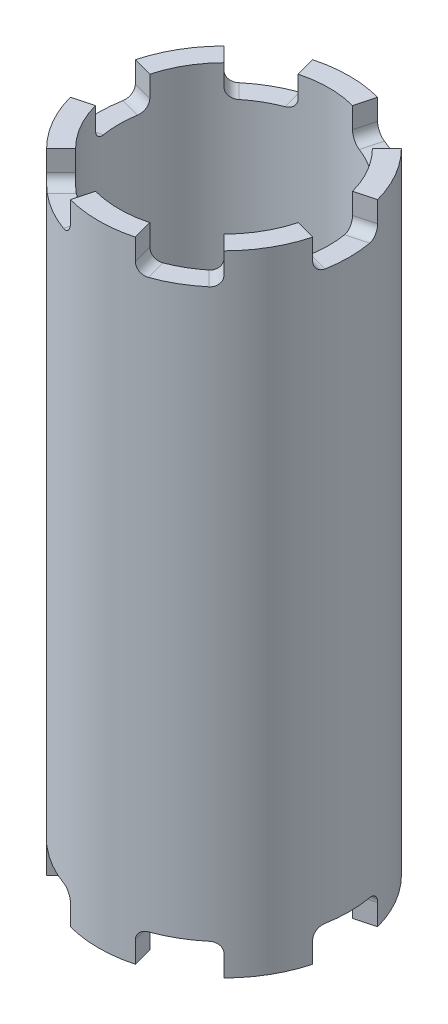
from build123d import *

# Parameters (mm, degrees)
SKETCH1_R            = 30.353
SKETCH1_R_2          = 25.4
BOSS_EXTRUDE1_DEPTH  = 152.4
CUT_EXTRUDE2_START   = -7.62
CUT_EXTRUDE2_DEPTH   = 7.62
FILLET1_R            = 2.54
FILLET1_OF_MIRROR1_R = 2.54


with BuildPart() as part:
    # Sketch1 → Boss-Extrude1 (new body)
    with BuildSketch(Plane(origin=(0, 0, 0), x_dir=(1, 0, 0), z_dir=(0, 1, 0))):
        with Locations(Location((0, 0, 0), (0, 0, 90))):
            Circle(SKETCH1_R)
        with Locations(Location((0, 0, 0), (0, 0, 90))):
            Circle(SKETCH1_R_2, mode=Mode.SUBTRACT)
    extrude(amount=BOSS_EXTRUDE1_DEPTH)

    # Sketch2 → Cut-Extrude2 (cut)
    with BuildSketch(Plane(origin=(0, 152.4, 0), x_dir=(1, 0, 0), z_dir=(0, 1, 0)).offset(CUT_EXTRUDE2_START)):
        with BuildLine():
            Line((24.534515988, 6.574003746), (29.318746605, 7.855934476))
            ThreePointArc((29.318746605, 7.855934476), (30.353, 0), (29.318746605, -7.855934476))
            Line((29.318746605, -7.855934476), (24.534515988, -6.574003746))
            ThreePointArc((24.534515988, -6.574003746), (25.4, 0), (24.534515988, 6.574003746))
        make_face()
        with BuildLine():
            Line((6.574003746, -24.534515988), (7.855934476, -29.318746605))
            ThreePointArc((7.855934476, -29.318746605), (15.1765, -26.286469081), (21.462812129, -21.462812129))
            Line((21.462812129, -21.462812129), (17.960512242, -17.960512242))
            ThreePointArc((17.960512242, -17.960512242), (12.7, -21.997045256), (6.574003746, -24.534515988))
        make_face()
        with BuildLine():
            Line((-17.960512242, -17.960512242), (-21.462812129, -21.462812129))
            ThreePointArc((-21.462812129, -21.462812129), (-15.1765, -26.286469081), (-7.855934476, -29.318746605))
            Line((-7.855934476, -29.318746605), (-6.574003746, -24.534515988))
            ThreePointArc((-6.574003746, -24.534515988), (-12.7, -21.997045256), (-17.960512242, -17.960512242))
        make_face()
        with BuildLine():
            Line((-24.534515988, 6.574003746), (-29.318746605, 7.855934476))
            ThreePointArc((-29.318746605, 7.855934476), (-30.353, 0), (-29.318746605, -7.855934476))
            Line((-29.318746605, -7.855934476), (-24.534515988, -6.574003746))
            ThreePointArc((-24.534515988, -6.574003746), (-25.4, 0), (-24.534515988, 6.574003746))
        make_face()
        with BuildLine():
            Line((-6.574003746, 24.534515988), (-7.855934476, 29.318746605))
            ThreePointArc((-7.855934476, 29.318746605), (-15.1765, 26.286469081), (-21.462812129, 21.462812129))
            Line((-21.462812129, 21.462812129), (-17.960512242, 17.960512242))
            ThreePointArc((-17.960512242, 17.960512242), (-12.7, 21.997045256), (-6.574003746, 24.534515988))
        make_face()
        with BuildLine():
            Line((17.960512242, 17.960512242), (21.462812129, 21.462812129))
            ThreePointArc((21.462812129, 21.462812129), (15.1765, 26.286469081), (7.855934476, 29.318746605))
            Line((7.855934476, 29.318746605), (6.574003746, 24.534515988))
            ThreePointArc((6.574003746, 24.534515988), (12.7, 21.997045256), (17.960512242, 17.960512242))
        make_face()
    cut_extrude2 = extrude(amount=CUT_EXTRUDE2_DEPTH, mode=Mode.SUBTRACT)

    # Fillet1
    fillet1_edges = [part.edges().sort_by_distance(p)[0] for p in [
        (26.926631297, 144.78, -7.214969111),
        (26.926631297, 144.78, 7.214969111),
        (7.214969111, 144.78, -26.926631297),
        (19.711662186, 144.78, -19.711662186),
        (-19.711662186, 144.78, -19.711662186),
        (-7.214969111, 144.78, -26.926631297),
        (-26.926631297, 144.78, 7.214969111),
        (-26.926631297, 144.78, -7.214969111),
        (-7.214969111, 144.78, 26.926631297),
        (-19.711662186, 144.78, 19.711662186),
        (19.711662186, 144.78, 19.711662186),
        (7.214969111, 144.78, 26.926631297),
    ]]
    fillet(fillet1_edges, radius=FILLET1_R)

    # Mirror1: Cut-Extrude2 across plane
    add(cut_extrude2.mirror(Plane(origin=(0, 76.2, 0), x_dir=(0, 0, 1), z_dir=(0, -1, 0))), mode=Mode.SUBTRACT)

    # Fillet1 of Mirror1
    fillet1_of_mirror1_edges = [part.edges().sort_by_distance(p)[0] for p in [
        (26.926631297, 7.62, -7.214969111),
        (26.926631297, 7.62, 7.214969111),
        (7.214969111, 7.62, -26.926631297),
        (19.711662186, 7.62, -19.711662186),
        (-19.711662186, 7.62, -19.711662186),
        (-7.214969111, 7.62, -26.926631297),
        (-26.926631297, 7.62, 7.214969111),
        (-26.926631297, 7.62, -7.214969111),
        (-7.214969111, 7.62, 26.926631297),
        (-19.711662186, 7.62, 19.711662186),
        (19.711662186, 7.62, 19.711662186),
        (7.214969111, 7.62, 26.926631297),
    ]]
    fillet(fillet1_of_mirror1_edges, radius=FILLET1_OF_MIRROR1_R)


solid = part.part
